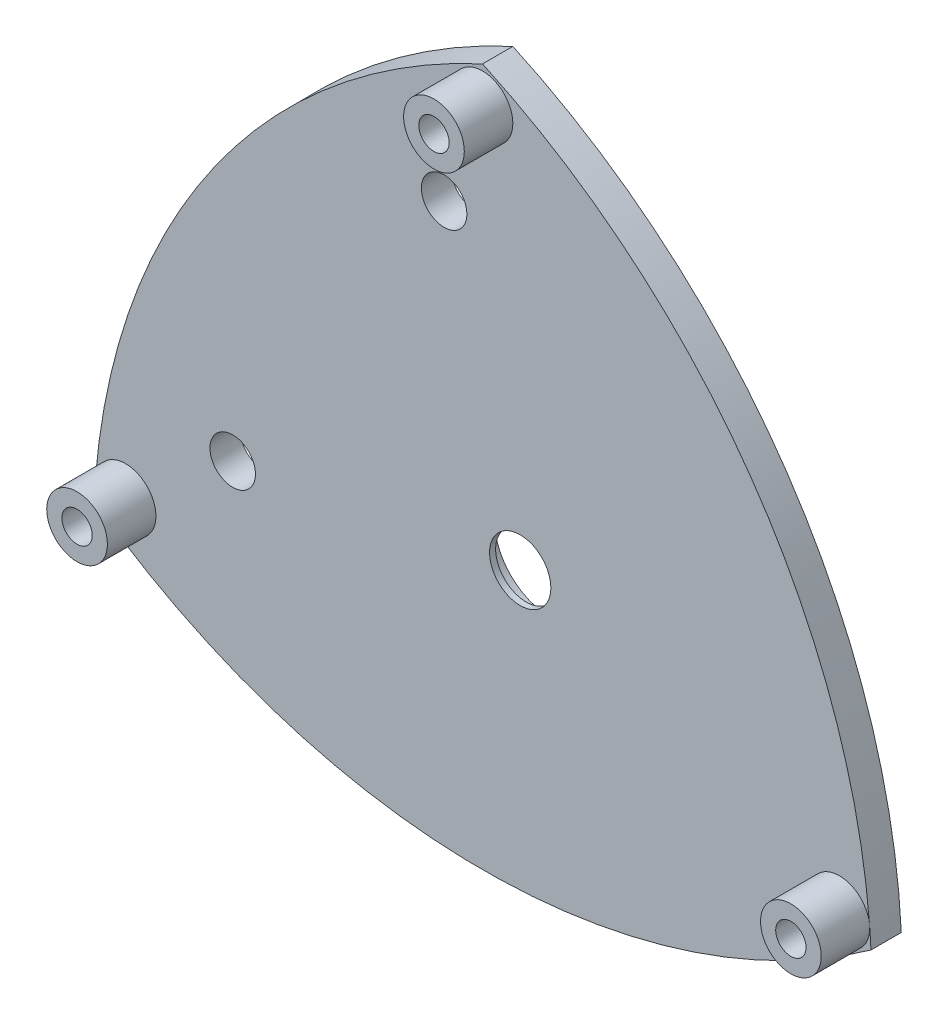
from build123d import *

# Parameters (mm, degrees)
SKETCH_1_R          = 5
EXTRUDE_1_DEPTH     = 10
SKETCH_2_R          = 10
SKETCH_2_R_2        = 5
EXTRUDE_2_DEPTH     = 16
SKETCH_3_R          = 7.5
CUT_EXTRUDE_1_DEPTH = 10
SKETCH_4_R          = 18.5
CUT_EXTRUDE_2_DEPTH = 10
SKETCH_5_R          = 18.5
SKETCH_5_R_2        = 10.1
EXTRUDE_3_DEPTH     = 2


with BuildPart() as part:
    # 草图1 → 凸台-拉伸1 (new body)
    with BuildSketch(Plane.XY):
        with BuildLine():
            ThreePointArc((-128.022678922, -73.913928138), (-90.421378279, 38.440519474), (0, 115))
            ThreePointArc((0, 115), (90.421378279, 38.440519474), (128.022678922, -73.913928138))
            ThreePointArc((128.022678922, -73.913928138), (0, -115), (-128.022678922, -73.913928138))
        make_face()
        with Locations((0, 103)):
            Circle(SKETCH_1_R, mode=Mode.SUBTRACT)
        with Locations((-117.630374076, -67.913928138)):
            Circle(SKETCH_1_R, mode=Mode.SUBTRACT)
        with Locations((117.630374076, -67.913928138)):
            Circle(SKETCH_1_R, mode=Mode.SUBTRACT)
    extrude(amount=EXTRUDE_1_DEPTH)

    # 草图2 → 凸台-拉伸2 (add)
    # profile 1 of 3: a face of its own
    with BuildSketch(Plane.XY.offset(10)):
        with Locations((0, 103)):
            Circle(SKETCH_2_R)
        with Locations((0, 103)):
            Circle(SKETCH_2_R_2, mode=Mode.SUBTRACT)
    # profile 2 of 3: a face of its own
    with BuildSketch(Plane.XY.offset(10)):
        with Locations(Location((-117.630374076, -67.913928138, 0), (0, 0, 179.375778052))):
            Circle(SKETCH_2_R)
        with Locations((-117.630374076, -67.913928138)):
            Circle(SKETCH_2_R_2, mode=Mode.SUBTRACT)
    # profile 3 of 3: a face of its own
    with BuildSketch(Plane.XY.offset(10)):
        with Locations(Location((117.630374076, -67.913928138, 0), (0, 0, 8.696571879))):
            Circle(SKETCH_2_R)
        with Locations((117.630374076, -67.913928138)):
            Circle(SKETCH_2_R_2, mode=Mode.SUBTRACT)
    extrude(amount=EXTRUDE_2_DEPTH)

    # 草图3 → 切除-拉伸1 (cut)
    with BuildSketch(Plane(origin=(0, 0, 0), x_dir=(-1, 0, 0), z_dir=(0, 0, -1))):
        with Locations((12.650995066, 69.515536741)):
            Circle(SKETCH_3_R)
        with Locations((82.334125615, -39.530718783)):
            Circle(SKETCH_3_R)
    extrude(amount=-CUT_EXTRUDE_1_DEPTH, mode=Mode.SUBTRACT)

    # 草图4 → 切除-拉伸2 (cut)
    with BuildSketch(Plane.XY.offset(10)):
        with Locations((12.425309319, -23.296523673)):
            Circle(SKETCH_4_R)
    extrude(amount=-CUT_EXTRUDE_2_DEPTH, mode=Mode.SUBTRACT)

    # 草图5 → 凸台-拉伸3 (add)
    with BuildSketch(Plane.XY.offset(10)):
        with Locations((12.425309319, -23.296523673)):
            Circle(SKETCH_5_R)
        with Locations((12.425309319, -23.296523673)):
            Circle(SKETCH_5_R_2, mode=Mode.SUBTRACT)
    extrude(amount=-EXTRUDE_3_DEPTH)


solid = part.part
